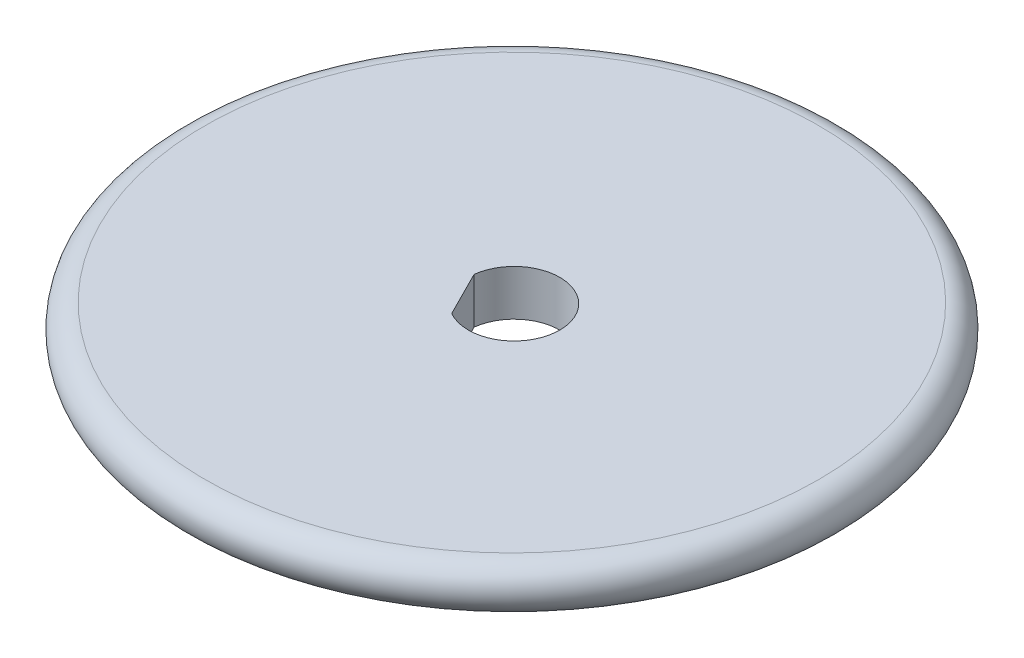
from build123d import *

# Parameters (mm, degrees)
CUT_EXTRUDE1_DEPTH = 27.020644672


with BuildPart() as part:
    # Sketch2 → Revolve1 (revolve)
    with BuildSketch(Plane.XY):
        with BuildLine():
            Line((0, 15.723376421), (0, 18.263376421))
            Line((0, 18.263376421), (17.041503786, 18.263376421))
            ThreePointArc((17.041503786, 18.263376421), (18.311503786, 16.993376421), (17.041503786, 15.723376421))
            Line((17.041503786, 15.723376421), (5.08, 15.723376421))
            Line((5.08, 15.723376421), (0, 15.723376421))
        make_face()
    revolve(axis=Axis((0, 15.723376421, 0), (0, 1, 0)))

    # Sketch3 → Cut-Extrude1 (cut, through all)
    with BuildSketch(Plane(origin=(0, 18.263376421, 0), x_dir=(1, 0, 0), z_dir=(0, 1, 0))):
        with BuildLine():
            Line((-1.145121305, -2.200846331), (-2.40767917, 0.303486678))
            ThreePointArc((-2.40767917, 0.303486678), (2.382755553, 1.148155871), (-1.145121305, -2.200846331))
        make_face()
    extrude(amount=-CUT_EXTRUDE1_DEPTH, mode=Mode.SUBTRACT)


solid = part.part
